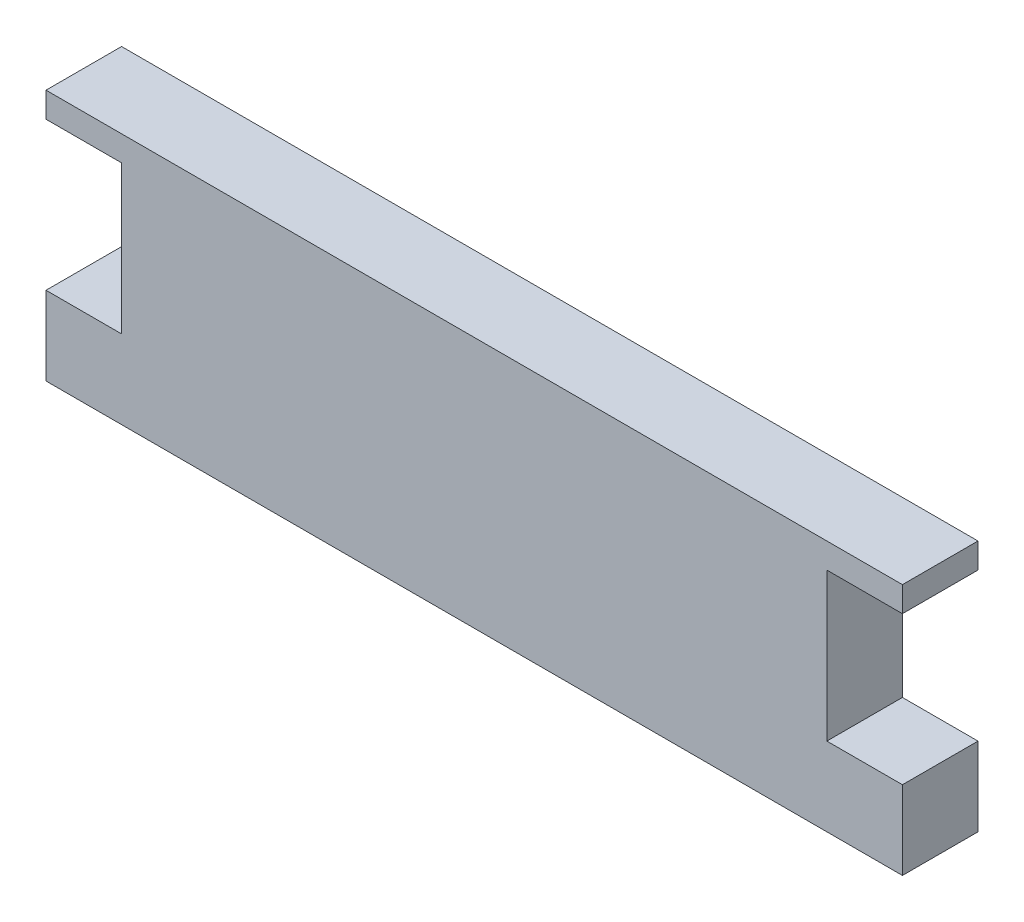
from build123d import *

# Parameters (mm, degrees)
BOSS_EXTRUDE1_DEPTH = 15


with BuildPart() as part:
    # Sketch1 → Boss-Extrude1 (new body)
    with BuildSketch(Plane.XY):
        Polygon((-43.442622951, -17.082502232), (-43.442622951, -32.68442623), (126.557377049, -32.68442623), (126.557377049, -17.082502232), (111.557377049, -17.082502232), (111.557377049, 12.315544642), (126.557377049, 12.315544642), (126.557377049, 17.31557377), (-43.442622951, 17.31557377), (-43.442622951, 12.315544642), (-28.442622951, 12.315544642), (-28.442622951, -17.082502232), align=None)
    extrude(amount=BOSS_EXTRUDE1_DEPTH)


solid = part.part
